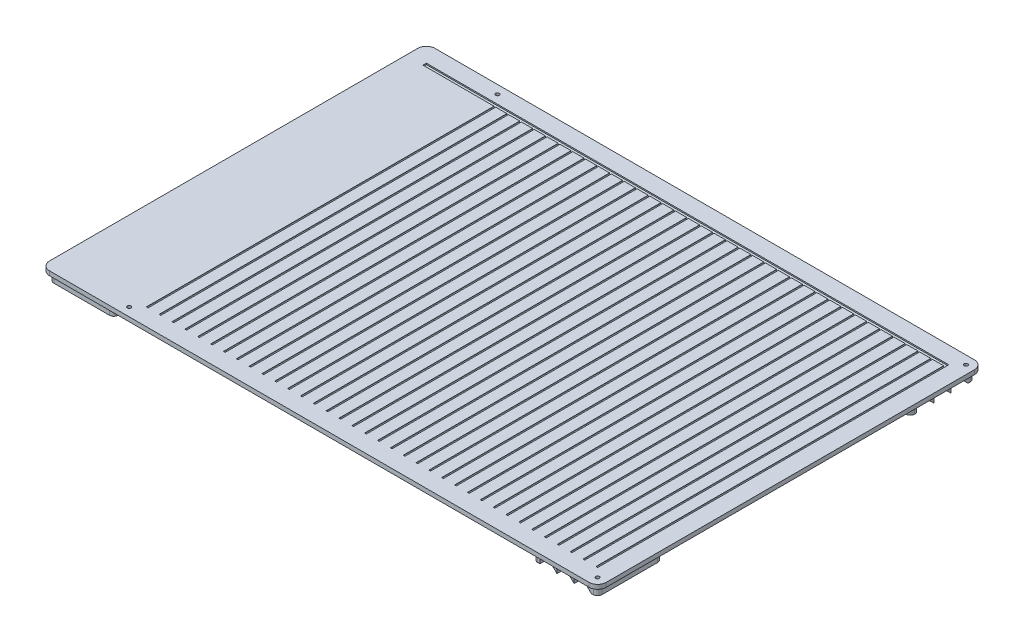
from build123d import *

# Parameters (mm, degrees)
BOSS_EXTRUDE1_DEPTH         = 5
CUT_EXTRUDE2_START          = -20
CUT_EXTRUDE2_DEPTH          = 410
SKETCH6_W                   = 4
SKETCH6_H                   = 1
SKETCH6_H_2                 = 0.5
CUT_EXTRUDE3_DEPTH          = 610
FILLET3_R                   = 10
BOSS_EXTRUDE2_DEPTH         = 10
CUT_EXTRUDE4_DEPTH          = 74.999999006
CUT_EXTRUDE5_DEPTH          = 75
CUT_EXTRUDE6_DEPTH          = 74.999998249
CUT_EXTRUDE7_DEPTH          = 74.999999006
TAP_DRILL_FOR_M5X0_8_TAP3_D = 4.2


with BuildPart() as part:
    # Sketch1 → Boss-Extrude1 (new body)
    with BuildSketch(Plane(origin=(0, 0, 0), x_dir=(1, 0, 0), z_dir=(0, 1, 0))):
        Polygon((-300, -225), (300, -225), (300, 225), (-300, 225), (-350, 225), (-350, -225), align=None)
    extrude(amount=BOSS_EXTRUDE1_DEPTH)

    # Sketch4 → Cut-Extrude2 (cut)
    with BuildSketch(Plane.XY.offset(225).offset(CUT_EXTRUDE2_START)):
        with BuildLine():
            Line((278, 4.5), (278, 5))
            Line((278, 5), (280, 5))
            Line((280, 5), (280, 4.5))
            ThreePointArc((280, 4.5), (279, 3.5), (278, 4.5))
        make_face()
        with BuildLine():
            Line((263, 4.5), (263, 5))
            Line((263, 5), (265, 5))
            Line((265, 5), (265, 4.5))
            ThreePointArc((265, 4.5), (264, 3.5), (263, 4.5))
        make_face()
        with BuildLine():
            Line((248, 4.5), (248, 5))
            Line((248, 5), (250, 5))
            Line((250, 5), (250, 4.5))
            ThreePointArc((250, 4.5), (249, 3.5), (248, 4.5))
        make_face()
        with BuildLine():
            Line((233, 4.5), (233, 5))
            Line((233, 5), (235, 5))
            Line((235, 5), (235, 4.5))
            ThreePointArc((235, 4.5), (234, 3.5), (233, 4.5))
        make_face()
        with BuildLine():
            Line((218, 4.5), (218, 5))
            Line((218, 5), (220, 5))
            Line((220, 5), (220, 4.5))
            ThreePointArc((220, 4.5), (219, 3.5), (218, 4.5))
        make_face()
        with BuildLine():
            Line((203, 4.5), (203, 5))
            Line((203, 5), (205, 5))
            Line((205, 5), (205, 4.5))
            ThreePointArc((205, 4.5), (204, 3.5), (203, 4.5))
        make_face()
        with BuildLine():
            Line((188, 4.5), (188, 5))
            Line((188, 5), (190, 5))
            Line((190, 5), (190, 4.5))
            ThreePointArc((190, 4.5), (189, 3.5), (188, 4.5))
        make_face()
        with BuildLine():
            Line((173, 4.5), (173, 5))
            Line((173, 5), (175, 5))
            Line((175, 5), (175, 4.5))
            ThreePointArc((175, 4.5), (174, 3.5), (173, 4.5))
        make_face()
        with BuildLine():
            Line((158, 4.5), (158, 5))
            Line((158, 5), (160, 5))
            Line((160, 5), (160, 4.5))
            ThreePointArc((160, 4.5), (159, 3.5), (158, 4.5))
        make_face()
        with BuildLine():
            Line((143, 4.5), (143, 5))
            Line((143, 5), (145, 5))
            Line((145, 5), (145, 4.5))
            ThreePointArc((145, 4.5), (144, 3.5), (143, 4.5))
        make_face()
        with BuildLine():
            Line((128, 4.5), (128, 5))
            Line((128, 5), (130, 5))
            Line((130, 5), (130, 4.5))
            ThreePointArc((130, 4.5), (129, 3.5), (128, 4.5))
        make_face()
        with BuildLine():
            Line((113, 4.5), (113, 5))
            Line((113, 5), (115, 5))
            Line((115, 5), (115, 4.5))
            ThreePointArc((115, 4.5), (114, 3.5), (113, 4.5))
        make_face()
        with BuildLine():
            Line((98, 4.5), (98, 5))
            Line((98, 5), (100, 5))
            Line((100, 5), (100, 4.5))
            ThreePointArc((100, 4.5), (99, 3.5), (98, 4.5))
        make_face()
        with BuildLine():
            Line((83, 4.5), (83, 5))
            Line((83, 5), (85, 5))
            Line((85, 5), (85, 4.5))
            ThreePointArc((85, 4.5), (84, 3.5), (83, 4.5))
        make_face()
        with BuildLine():
            Line((68, 4.5), (68, 5))
            Line((68, 5), (70, 5))
            Line((70, 5), (70, 4.5))
            ThreePointArc((70, 4.5), (69, 3.5), (68, 4.5))
        make_face()
        with BuildLine():
            Line((53, 4.5), (53, 5))
            Line((53, 5), (55, 5))
            Line((55, 5), (55, 4.5))
            ThreePointArc((55, 4.5), (54, 3.5), (53, 4.5))
        make_face()
        with BuildLine():
            Line((38, 4.5), (38, 5))
            Line((38, 5), (40, 5))
            Line((40, 5), (40, 4.5))
            ThreePointArc((40, 4.5), (39, 3.5), (38, 4.5))
        make_face()
        with BuildLine():
            Line((23, 4.5), (23, 5))
            Line((23, 5), (25, 5))
            Line((25, 5), (25, 4.5))
            ThreePointArc((25, 4.5), (24, 3.5), (23, 4.5))
        make_face()
        with BuildLine():
            Line((8, 4.5), (8, 5))
            Line((8, 5), (10, 5))
            Line((10, 5), (10, 4.5))
            ThreePointArc((10, 4.5), (9, 3.5), (8, 4.5))
        make_face()
        with BuildLine():
            Line((-7, 4.5), (-7, 5))
            Line((-7, 5), (-5, 5))
            Line((-5, 5), (-5, 4.5))
            ThreePointArc((-5, 4.5), (-6, 3.5), (-7, 4.5))
        make_face()
        with BuildLine():
            Line((-22, 4.5), (-22, 5))
            Line((-22, 5), (-20, 5))
            Line((-20, 5), (-20, 4.5))
            ThreePointArc((-20, 4.5), (-21, 3.5), (-22, 4.5))
        make_face()
        with BuildLine():
            Line((-37, 4.5), (-37, 5))
            Line((-37, 5), (-35, 5))
            Line((-35, 5), (-35, 4.5))
            ThreePointArc((-35, 4.5), (-36, 3.5), (-37, 4.5))
        make_face()
        with BuildLine():
            Line((-52, 4.5), (-52, 5))
            Line((-52, 5), (-50, 5))
            Line((-50, 5), (-50, 4.5))
            ThreePointArc((-50, 4.5), (-51, 3.5), (-52, 4.5))
        make_face()
        with BuildLine():
            Line((-67, 4.5), (-67, 5))
            Line((-67, 5), (-65, 5))
            Line((-65, 5), (-65, 4.5))
            ThreePointArc((-65, 4.5), (-66, 3.5), (-67, 4.5))
        make_face()
        with BuildLine():
            Line((-82, 4.5), (-82, 5))
            Line((-82, 5), (-80, 5))
            Line((-80, 5), (-80, 4.5))
            ThreePointArc((-80, 4.5), (-81, 3.5), (-82, 4.5))
        make_face()
        with BuildLine():
            Line((-97, 4.5), (-97, 5))
            Line((-97, 5), (-95, 5))
            Line((-95, 5), (-95, 4.5))
            ThreePointArc((-95, 4.5), (-96, 3.5), (-97, 4.5))
        make_face()
        with BuildLine():
            Line((-112, 4.5), (-112, 5))
            Line((-112, 5), (-110, 5))
            Line((-110, 5), (-110, 4.5))
            ThreePointArc((-110, 4.5), (-111, 3.5), (-112, 4.5))
        make_face()
        with BuildLine():
            Line((-127, 4.5), (-127, 5))
            Line((-127, 5), (-125, 5))
            Line((-125, 5), (-125, 4.5))
            ThreePointArc((-125, 4.5), (-126, 3.5), (-127, 4.5))
        make_face()
        with BuildLine():
            Line((-142, 4.5), (-142, 5))
            Line((-142, 5), (-140, 5))
            Line((-140, 5), (-140, 4.5))
            ThreePointArc((-140, 4.5), (-141, 3.5), (-142, 4.5))
        make_face()
        with BuildLine():
            Line((-157, 4.5), (-157, 5))
            Line((-157, 5), (-155, 5))
            Line((-155, 5), (-155, 4.5))
            ThreePointArc((-155, 4.5), (-156, 3.5), (-157, 4.5))
        make_face()
        with BuildLine():
            Line((-172, 4.5), (-172, 5))
            Line((-172, 5), (-170, 5))
            Line((-170, 5), (-170, 4.5))
            ThreePointArc((-170, 4.5), (-171, 3.5), (-172, 4.5))
        make_face()
        with BuildLine():
            Line((-187, 4.5), (-187, 5))
            Line((-187, 5), (-185, 5))
            Line((-185, 5), (-185, 4.5))
            ThreePointArc((-185, 4.5), (-186, 3.5), (-187, 4.5))
        make_face()
        with BuildLine():
            Line((-202, 4.5), (-202, 5))
            Line((-202, 5), (-200, 5))
            Line((-200, 5), (-200, 4.5))
            ThreePointArc((-200, 4.5), (-201, 3.5), (-202, 4.5))
        make_face()
        with BuildLine():
            Line((-217, 4.5), (-217, 5))
            Line((-217, 5), (-215, 5))
            Line((-215, 5), (-215, 4.5))
            ThreePointArc((-215, 4.5), (-216, 3.5), (-217, 4.5))
        make_face()
        with BuildLine():
            Line((-232, 4.5), (-232, 5))
            Line((-232, 5), (-230, 5))
            Line((-230, 5), (-230, 4.5))
            ThreePointArc((-230, 4.5), (-231, 3.5), (-232, 4.5))
        make_face()
        with BuildLine():
            Line((-247, 4.5), (-247, 5))
            Line((-247, 5), (-245, 5))
            Line((-245, 5), (-245, 4.5))
            ThreePointArc((-245, 4.5), (-246, 3.5), (-247, 4.5))
        make_face()
    extrude(amount=-CUT_EXTRUDE2_DEPTH, mode=Mode.SUBTRACT)

    # Sketch6 → Cut-Extrude3 (cut)
    with BuildSketch(Plane.ZY.offset(-280)):
        with Locations((-203, 4)):
            Rectangle(SKETCH6_W, SKETCH6_H)
        with Locations((-203, 4.75)):
            Rectangle(SKETCH6_W, SKETCH6_H_2)
    extrude(amount=CUT_EXTRUDE3_DEPTH, mode=Mode.SUBTRACT)

    # Fillet3
    fillet3_edges = [part.edges().sort_by_distance(p)[0] for p in [
        (300, 2.5, 225),
        (-350, 2.5, 225),
        (-350, 2.5, -225),
        (300, 2.5, -225),
    ]]
    fillet(fillet3_edges, radius=FILLET3_R)

    # Sketch16 → Boss-Extrude2 (add)
    with BuildSketch(Plane.XZ):
        with BuildLine():
            Line((-270.000000236, -215), (-270.000000236, -150.000000994))
            ThreePointArc((-270.000000236, -150.000000994), (-271.46446633, -146.464467088), (-275.000000236, -145.000000994))
            Line((-275.000000236, -145.000000994), (-340, -145.000000994))
            ThreePointArc((-340, -145.000000994), (-343.535533906, -146.464467088), (-345, -150.000000994))
            Line((-345, -150.000000994), (-345, -215))
            ThreePointArc((-345, -215), (-343.535533906, -218.535533906), (-340, -220))
            Line((-340, -220), (-275.000000236, -220))
            ThreePointArc((-275.000000236, -220), (-271.46446633, -218.535533906), (-270.000000236, -215))
        make_face()
        with BuildLine():
            ThreePointArc((-340, 145.000001751), (-343.535533906, 146.464467845), (-345, 150.000001751))
            Line((-345, 150.000001751), (-345, 215))
            ThreePointArc((-345, 215), (-343.535533906, 218.535533906), (-340, 220))
            Line((-340, 220), (-275.000000236, 220))
            ThreePointArc((-275.000000236, 220), (-271.464466163, 218.535533837), (-270, 214.999999764))
            Line((-270, 214.999999764), (-270, 150.000001988))
            ThreePointArc((-270, 150.000001988), (-271.464466163, 146.464467915), (-275.000000236, 145.000001751))
            Line((-275.000000236, 145.000001751), (-340, 145.000001751))
        make_face()
        with BuildLine():
            ThreePointArc((225.000000994, 145.000001751), (221.464467356, 146.464467734), (220.000001373, 150.000001373))
            Line((220.000001373, 150.000001373), (220.000001373, 215.000000379))
            ThreePointArc((220.000001373, 215.000000379), (221.464467356, 218.535534017), (225.000000994, 220))
            Line((225.000000994, 220), (290, 220))
            ThreePointArc((290, 220), (293.535533906, 218.535533906), (295, 215))
            Line((295, 215), (295, 150.000001751))
            ThreePointArc((295, 150.000001751), (293.535533906, 146.464467845), (290, 145.000001751))
            Line((290, 145.000001751), (225.000000994, 145.000001751))
        make_face()
        with BuildLine():
            Line((290, -145.000000994), (225.000000994, -145.000000994))
            ThreePointArc((225.000000994, -145.000000994), (221.464467088, -146.464467088), (220.000000994, -150.000000994))
            Line((220.000000994, -150.000000994), (220.000000994, -215))
            ThreePointArc((220.000000994, -215), (221.464467088, -218.535533906), (225.000000994, -220))
            Line((225.000000994, -220), (290, -220))
            ThreePointArc((290, -220), (293.535533906, -218.535533906), (295, -215))
            Line((295, -215), (295, -150.000000994))
            ThreePointArc((295, -150.000000994), (293.535533906, -146.464467088), (290, -145.000000994))
        make_face()
    extrude(amount=BOSS_EXTRUDE2_DEPTH)

    # Sketch17 → Cut-Extrude4 (cut)
    with BuildSketch(Plane(origin=(0, 0, -220), x_dir=(-1, 0, 0), z_dir=(0, 0, -1))):
        Polygon((317.5, -10), (337.5, -10), (327.5, 0), (317.5, 0), align=None)
        Polygon((277.5, -10), (297.5, -10), (287.5, 0), (277.5, 0), align=None)
        Polygon((297.5, -10), (317.5, -10), (307.5, 0), (297.5, 0), align=None)
    extrude(amount=-CUT_EXTRUDE4_DEPTH, mode=Mode.SUBTRACT)

    # Sketch18 → Cut-Extrude5 (cut)
    with BuildSketch(Plane.ZY.offset(345)):
        Polygon((192.5, -10), (212.5, -10), (202.5, 0), (192.5, 0), align=None)
        Polygon((172.5, -10), (192.5, -10), (182.5, 0), (172.5, 0), align=None)
        Polygon((152.5, -10), (172.5, -10), (162.5, 0), (152.5, 0), align=None)
    extrude(amount=-CUT_EXTRUDE5_DEPTH, mode=Mode.SUBTRACT)

    # Sketch19 → Cut-Extrude6 (cut)
    with BuildSketch(Plane.XY.offset(220)):
        Polygon((267.5, -10), (287.5, -10), (277.5, 0), (267.5, 0), align=None)
        Polygon((247.5, -10), (267.5, -10), (257.5, 0), (247.5, 0), align=None)
        Polygon((227.5, -10), (247.5, -10), (237.5, 0), (227.5, 0), align=None)
    extrude(amount=-CUT_EXTRUDE6_DEPTH, mode=Mode.SUBTRACT)

    # Sketch20 → Cut-Extrude7 (cut)
    with BuildSketch(Plane(origin=(295, 0, 0), x_dir=(0, 0, -1), z_dir=(1, 0, 0))):
        Polygon((192.5, -10), (212.5, -10), (202.5, 0), (192.5, 0), align=None)
        Polygon((172.5, -10), (192.5, -10), (182.5, 0), (172.5, 0), align=None)
        Polygon((152.5, -10), (172.5, -10), (162.5, 0), (152.5, 0), align=None)
    extrude(amount=-CUT_EXTRUDE7_DEPTH, mode=Mode.SUBTRACT)

    # Tap Drill for M5x0.8 Tap3 (through all)
    with Locations(Plane(origin=(-257, 5, 215), x_dir=(0, 0, 1), z_dir=(0, 1, 0))):
        with Locations((0, 0), (-430, 0), (-430, 547), (0, 547)):
            Hole(TAP_DRILL_FOR_M5X0_8_TAP3_D / 2)


solid = part.part
